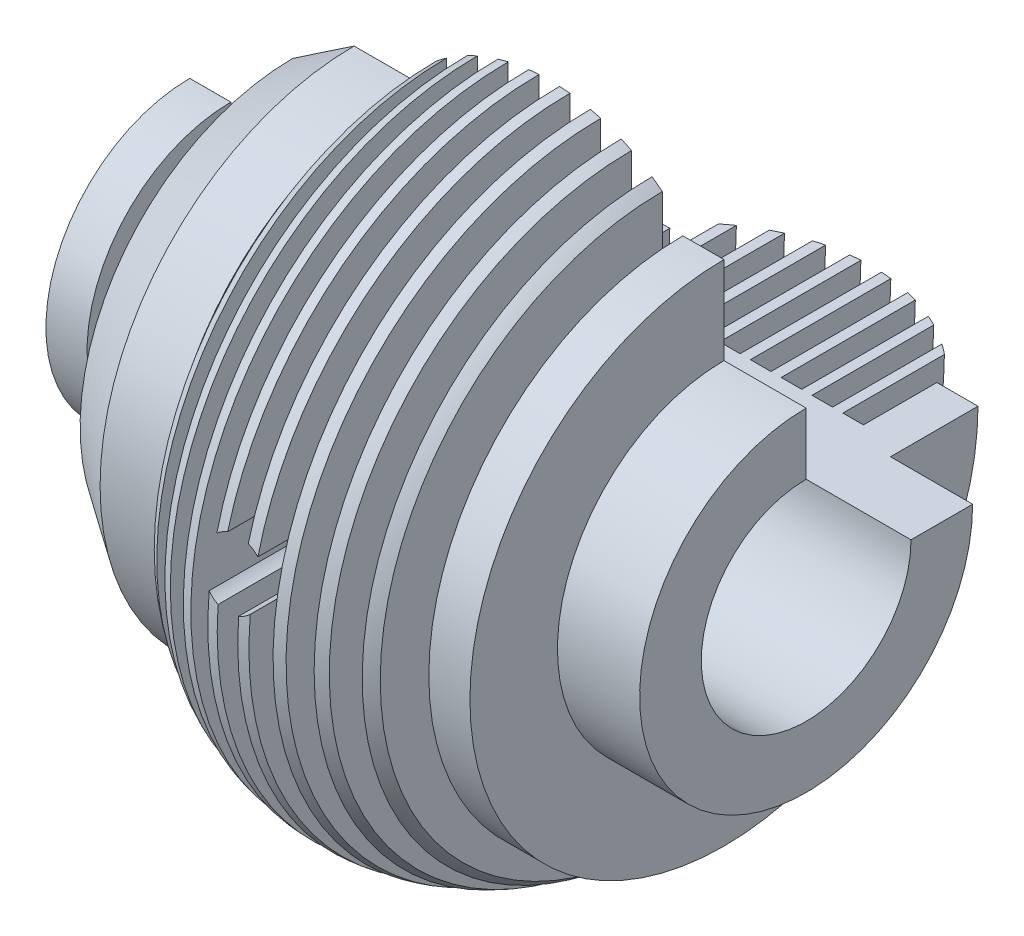
from build123d import *

# Parameters (mm, degrees)
REVOLVE1_ANGLE     = 270
SKETCH11_R         = 7.5
CUT_EXTRUDE1_DEPTH = 103


with BuildPart() as part:
    # Sketch10 → Revolve1 (revolve)
    with BuildSketch(Plane.XY):
        with BuildLine():
            Line((-146.868713488, 1.727510523), (-96.868713488, 1.727510523))
            Line((-96.868713488, 1.727510523), (-96.868713488, 12.246455007))
            Line((-96.868713488, 12.246455007), (3.131286512, 12.246455007))
            Line((3.131286512, 12.246455007), (3.131286512, 27.246455007))
            Line((3.131286512, 27.246455007), (-16.868713488, 27.246455007))
            Line((-16.868713488, 27.246455007), (-16.868713488, 48.546455007))
            Line((-16.868713488, 48.546455007), (-26.868713488, 48.546455007))
            Line((-26.868713488, 48.546455007), (-26.868713488, 30.664510563))
            Line((-26.868713488, 30.664510563), (-31.868713488, 30.664510563))
            Line((-31.868713488, 30.664510563), (-31.868713488, 55.369461788))
            ThreePointArc((-31.868713488, 55.369461788), (-33.10183862, 56.333258752), (-34.368713488, 57.252242021))
            Line((-34.368713488, 57.252242021), (-34.368713488, 30.664510563))
            Line((-34.368713488, 30.664510563), (-39.368713488, 30.664510563))
            Line((-39.368713488, 30.664510563), (-39.368713488, 60.267954644))
            ThreePointArc((-39.368713488, 60.267954644), (-40.609283081, 60.882526075), (-41.868713488, 61.457457384))
            Line((-41.868713488, 61.457457384), (-41.868713488, 30.664510563))
            Line((-41.868713488, 30.664510563), (-46.868713488, 30.664510563))
            Line((-46.868713488, 30.664510563), (-46.868713488, 63.290372193))
            ThreePointArc((-46.868713488, 63.290372193), (-48.113771821, 63.642379564), (-49.368713488, 63.957341236))
            Line((-49.368713488, 63.957341236), (-49.368713488, 30.664510563))
            Line((-49.368713488, 30.664510563), (-54.368713488, 30.664510563))
            Line((-54.368713488, 30.664510563), (-54.368713488, 64.830682747))
            ThreePointArc((-54.368713488, 64.830682747), (-55.617164341, 64.956446576), (-56.868713488, 65.046284243))
            Line((-56.868713488, 65.046284243), (-56.868713488, 30.664510563))
            Line((-56.868713488, 30.664510563), (-61.868713488, 30.664510563))
            Line((-61.868713488, 30.664510563), (-61.868713488, 65.046284243))
            ThreePointArc((-61.868713488, 65.046284243), (-63.120262635, 64.956446576), (-64.368713488, 64.830682747))
            Line((-64.368713488, 64.830682747), (-64.368713488, 30.664510563))
            Line((-64.368713488, 30.664510563), (-69.368713488, 30.664510563))
            Line((-69.368713488, 30.664510563), (-69.368713488, 63.957341236))
            ThreePointArc((-69.368713488, 63.957341236), (-70.623655155, 63.642379564), (-71.868713488, 63.290372193))
            Line((-71.868713488, 63.290372193), (-71.868713488, 30.664510563))
            Line((-71.868713488, 30.664510563), (-76.868713488, 30.664510563))
            Line((-76.868713488, 30.664510563), (-76.868713488, 61.457457384))
            ThreePointArc((-76.868713488, 61.457457384), (-78.128143895, 60.882526075), (-79.368713488, 60.267954644))
            Line((-79.368713488, 60.267954644), (-79.368713488, 30.664510563))
            Line((-79.368713488, 30.664510563), (-84.368713488, 30.664510563))
            Line((-84.368713488, 30.664510563), (-84.368713488, 57.252242021))
            ThreePointArc((-84.368713488, 57.252242021), (-85.635588357, 56.333258752), (-86.868713488, 55.369461788))
            Line((-86.868713488, 55.369461788), (-86.868713488, 30.664510563))
            Line((-86.868713488, 30.664510563), (-91.868713488, 30.664510563))
            Line((-91.868713488, 30.664510563), (-91.868713488, 48.546455007))
            Line((-91.868713488, 48.546455007), (-106.868713488, 48.546455007))
            Line((-106.868713488, 48.546455007), (-121.791389794, 38.480982745))
            Line((-121.791389794, 38.480982745), (-121.791389794, 21.727510523))
            ThreePointArc((-121.791389794, 21.727510523), (-124.720321982, 14.656442711), (-131.791389794, 11.727510523))
            Line((-131.791389794, 11.727510523), (-136.868713488, 11.727510523))
            Line((-136.868713488, 11.727510523), (-136.868713488, 21.727510523))
            Line((-136.868713488, 21.727510523), (-146.868713488, 21.727510523))
            Line((-146.868713488, 21.727510523), (-146.868713488, 1.727510523))
        make_face()
    revolve(axis=Axis((-146.868713488, -13.272489477, 0), (1, 0, 0)), revolution_arc=REVOLVE1_ANGLE)

    # Sketch11 → Cut-Extrude1 (cut)
    with BuildSketch(Plane(origin=(0, 0, 0), x_dir=(-1, 0, 0), z_dir=(0, 0, -1))):
        with Locations((59.368713488, -0.513017235)):
            Circle(SKETCH11_R)
    extrude(amount=-CUT_EXTRUDE1_DEPTH, mode=Mode.SUBTRACT)


solid = part.part
